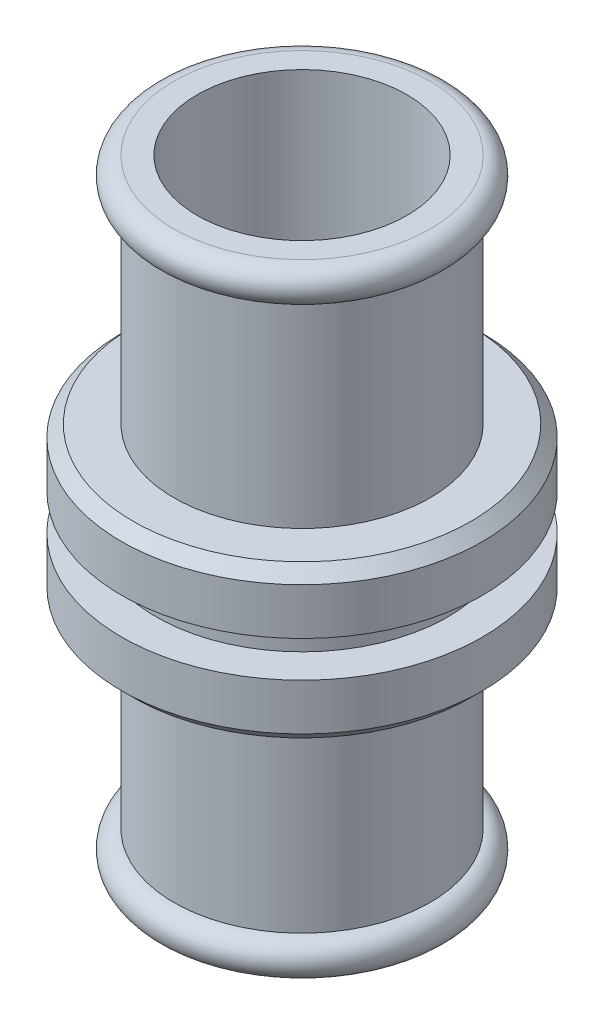
from build123d import *

# Parameters (mm, degrees)
CROQUIS1_W   = 3.515255872
CROQUIS1_H   = 1.551138095
CROQUIS1_H_2 = 1.551138096


with BuildPart() as part:
    # Croquis1 → Revolución1 (revolve)
    with BuildSketch(Plane.XY, mode=Mode.PRIVATE) as revoluci_n1_sk:
        with BuildLine():
            ThreePointArc((3.25, 12.5), (4.75, 11), (3.25, 9.5))
            Line((3.25, 9.5), (3.25, -7.5))
            Line((3.25, -7.5), (6.75, -7.5))
            Line((6.75, -7.5), (7.75, -8.5))
            Line((7.75, -8.5), (7.75, -12.5))
            Line((7.75, -12.5), (1.25, -12.5))
            Line((1.25, -12.5), (1.25, 12.5))
            Line((1.25, 12.5), (3.25, 12.5))
        make_face()
        with Locations((3.007627936, -13.275569047)):
            Rectangle(CROQUIS1_W, CROQUIS1_H)
        with Locations((3.007627936, -14.826707143)):
            Rectangle(CROQUIS1_W, CROQUIS1_H_2)
        with BuildLine():
            Line((7.75, -15.602276191), (4.765255872, -15.602276191))
            Line((4.765255872, -15.602276191), (1.25, -15.602276191))
            Line((1.25, -15.602276191), (1.25, -40.602276191))
            Line((1.25, -40.602276191), (3.25, -40.602276191))
            ThreePointArc((3.25, -40.602276191), (4.75, -39.102276191), (3.25, -37.602276191))
            Line((3.25, -37.602276191), (3.25, -20.602276191))
            Line((3.25, -20.602276191), (6.75, -20.602276191))
            Line((6.75, -20.602276191), (7.75, -19.602276191))
            Line((7.75, -19.602276191), (7.75, -15.602276191))
        make_face()
    revolve(revoluci_n1_sk.sketch.rotate(Axis((-7.75, -7.5, 0), (0, 1, 0)), 90), axis=Axis((-7.75, -7.5, 0), (0, 1, 0)))


solid = part.part
